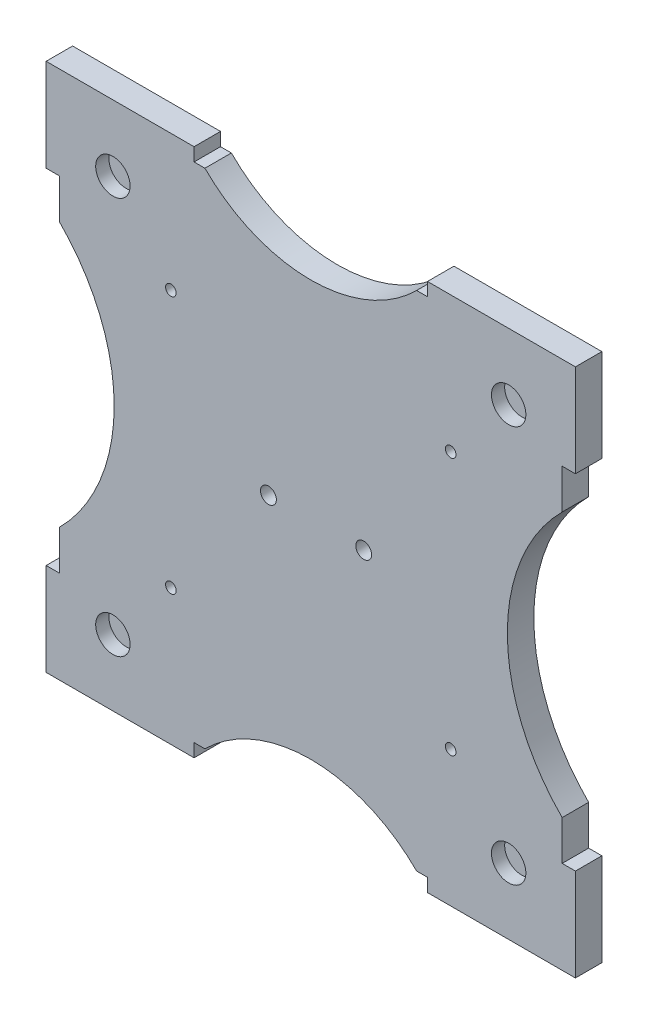
from build123d import *

# Parameters (mm, degrees)
SKETCH1_R           = 1.5
BOSS_EXTRUDE1_DEPTH = 10
SKETCH2_R           = 2
CUT_EXTRUDE1_DEPTH  = 10
BOSS_EXTRUDE2_START = -10
SKETCH3_R           = 1.5
BOSS_EXTRUDE2_DEPTH = 10
BOSS_EXTRUDE3_START = -10
SKETCH5_R           = 1.5
BOSS_EXTRUDE3_DEPTH = 10
SKETCH6_R           = 6.5
CUT_EXTRUDE3_DEPTH  = 5
SKETCH8_R           = 3
CUT_EXTRUDE4_DEPTH  = 10


with BuildPart() as part:
    # Sketch1 → Boss-Extrude1 (new body)
    with BuildSketch(Plane.XY):
        with BuildLine():
            ThreePointArc((-40, 95), (0, 78.431457505), (40, 95))
            Line((40, 95), (44.1, 95))
            Line((44.1, 95), (44.1, 100))
            Line((44.1, 100), (100, 100))
            Line((100, 100), (100, 65))
            Line((100, 65), (95, 65))
            Line((95, 65), (95, 50))
            ThreePointArc((95, 50), (74.289321881, 0), (95, -50))
            Line((95, -50), (95, -65))
            Line((95, -65), (100, -65))
            Line((100, -65), (100, -100))
            Line((100, -100), (44.1, -100))
            Line((44.1, -100), (44.1, -95))
            Line((44.1, -95), (40, -95))
            ThreePointArc((40, -95), (0, -78.431457505), (-40, -95))
            Line((-40, -95), (-44.1, -95))
            Line((-44.1, -95), (-44.1, -100))
            Line((-44.1, -100), (-100, -100))
            Line((-100, -100), (-100, -65))
            Line((-100, -65), (-95, -65))
            Line((-95, -65), (-95, -50))
            ThreePointArc((-95, -50), (-74.289321881, 0), (-95, 50))
            Line((-95, 50), (-95, 65))
            Line((-95, 65), (-100, 65))
            Line((-100, 65), (-100, 100))
            Line((-100, 100), (-44.1, 100))
            Line((-44.1, 100), (-44.1, 95))
            Line((-44.1, 95), (-40, 95))
        make_face()
        with Locations((74.775, -75)):
            Circle(SKETCH1_R, mode=Mode.SUBTRACT)
        with Locations((-74.775, -75)):
            Circle(SKETCH1_R, mode=Mode.SUBTRACT)
        with Locations((-74.775, 75)):
            Circle(SKETCH1_R, mode=Mode.SUBTRACT)
        with Locations((74.775, 75)):
            Circle(SKETCH1_R, mode=Mode.SUBTRACT)
    extrude(amount=BOSS_EXTRUDE1_DEPTH)

    # Sketch2 → Cut-Extrude1 (cut)
    with BuildSketch(Plane.XY.offset(10)):
        with Locations((52.87, -48.68)):
            Circle(SKETCH2_R)
        with Locations((-52.87, -48.68)):
            Circle(SKETCH2_R)
        with Locations((52.87, 48.68)):
            Circle(SKETCH2_R)
        with Locations((-52.87, 48.68)):
            Circle(SKETCH2_R)
    extrude(amount=-CUT_EXTRUDE1_DEPTH, mode=Mode.SUBTRACT)

    # Sketch3 → Boss-Extrude2 (add)
    with BuildSketch(Plane.XY.offset(10).offset(BOSS_EXTRUDE2_START)):
        with Locations((74.775, -75)):
            Circle(SKETCH3_R)
    extrude(amount=BOSS_EXTRUDE2_DEPTH)

    # Sketch5 → Boss-Extrude3 (add)
    with BuildSketch(Plane.XY.offset(10).offset(BOSS_EXTRUDE3_START)):
        with Locations((-74.775, -75)):
            Circle(SKETCH5_R)
        with Locations((-74.775, 75)):
            Circle(SKETCH5_R)
        with Locations((74.775, 75)):
            Circle(SKETCH5_R)
    extrude(amount=BOSS_EXTRUDE3_DEPTH)

    # Sketch6 → Cut-Extrude3 (cut)
    with BuildSketch(Plane.XY.offset(10)):
        with Locations((-74.775, 75)):
            Circle(SKETCH6_R)
        with Locations((74.775, 75)):
            Circle(SKETCH6_R)
        with Locations((74.775, -75)):
            Circle(SKETCH6_R)
        with Locations((-74.775, -75)):
            Circle(SKETCH6_R)
    extrude(amount=-CUT_EXTRUDE3_DEPTH, mode=Mode.SUBTRACT)

    # Sketch8 → Cut-Extrude4 (cut)
    with BuildSketch(Plane.XY.offset(10)):
        with Locations((20, 0)):
            Circle(SKETCH8_R)
        with Locations((-16, 0)):
            Circle(SKETCH8_R)
    extrude(amount=-CUT_EXTRUDE4_DEPTH, mode=Mode.SUBTRACT)


solid = part.part
